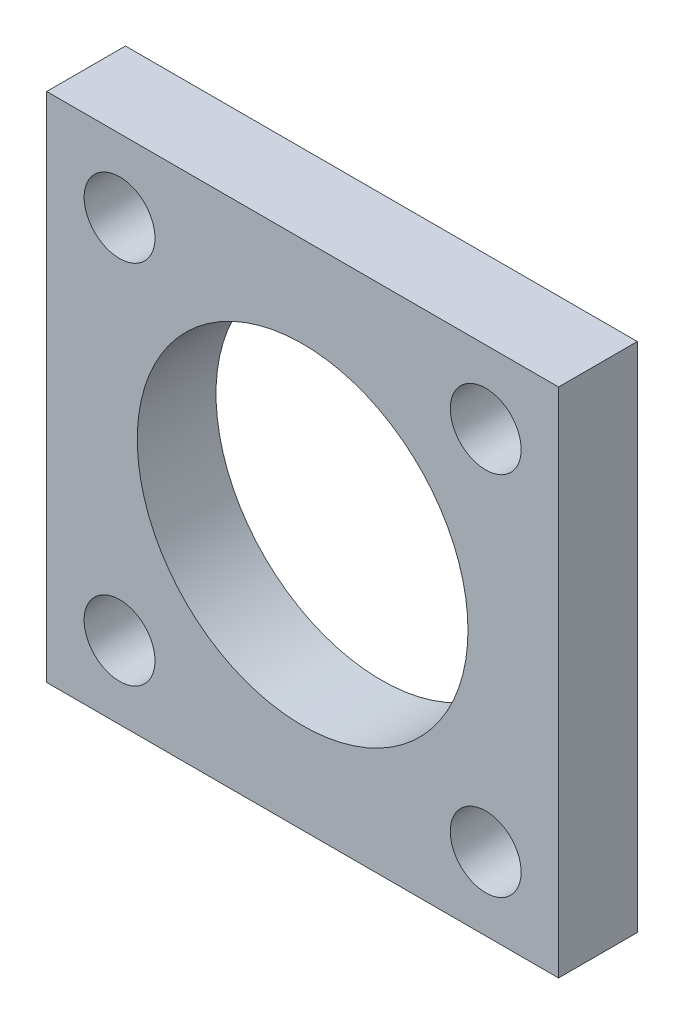
from build123d import *

# Parameters (mm, degrees)
SZKIC1_W                    = 65
SZKIC1_H                    = 65
SZKIC1_R                    = 21
SZKIC1_R_2                  = 4.5
DODANIE_WYCI_GNI_CIE1_DEPTH = 10


with BuildPart() as part:
    # Szkic1 → Dodanie-wyciągnięcie1 (new body)
    with BuildSketch(Plane.XY):
        Rectangle(SZKIC1_W, SZKIC1_H)
        Circle(SZKIC1_R, mode=Mode.SUBTRACT)
        with Locations((-23.25, 23.25)):
            Circle(SZKIC1_R_2, mode=Mode.SUBTRACT)
        with Locations((23.25, 23.25)):
            Circle(SZKIC1_R_2, mode=Mode.SUBTRACT)
        with Locations((23.25, -23.25)):
            Circle(SZKIC1_R_2, mode=Mode.SUBTRACT)
        with Locations((-23.25, -23.25)):
            Circle(SZKIC1_R_2, mode=Mode.SUBTRACT)
    extrude(amount=DODANIE_WYCI_GNI_CIE1_DEPTH)


solid = part.part
